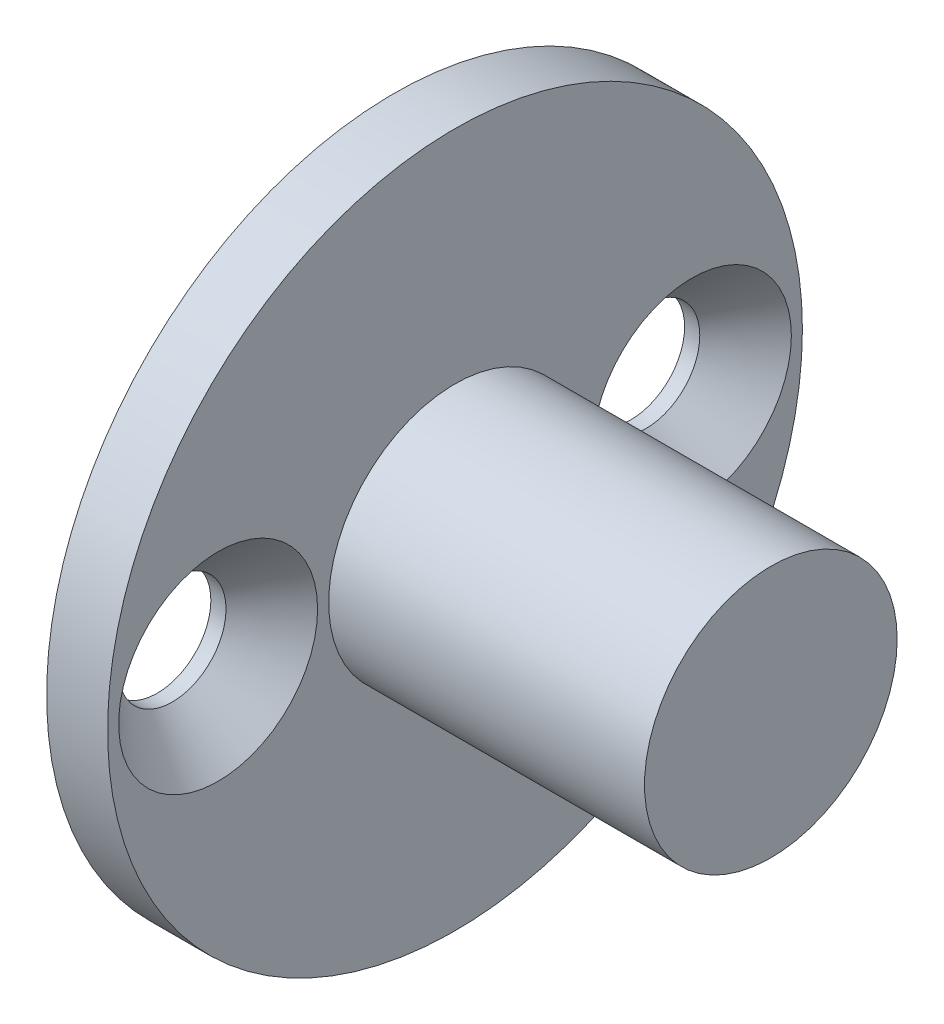
from build123d import *

# Parameters (mm, degrees)
SKETCH1_R                                      = 11
SKETCH1_R_2                                    = 1.6
BOSS_EXTRUDE1_DEPTH                            = 1.93
SKETCH2_R                                      = 4
BOSS_EXTRUDE2_DEPTH                            = 10
SKETCH3_R                                      = 2.15
CUT_EXTRUDE1_DEPTH                             = 6
CSK_FOR_M3_FLAT_HEAD_MACHINE_SCREW1_AT_2_COUNT = 2
CSK_FOR_M3_FLAT_HEAD_MACHINE_SCREW1_AT_2_PITCH = 15


with BuildPart() as part:
    # Sketch1 → Boss-Extrude1 (new body)
    with BuildSketch(Plane(origin=(0, 0, 0), x_dir=(0, 0, -1), z_dir=(1, 0, 0))):
        Circle(SKETCH1_R)
        with Locations((7.5, 0)):
            Circle(SKETCH1_R_2, mode=Mode.SUBTRACT)
        with Locations((-7.5, 0)):
            Circle(SKETCH1_R_2, mode=Mode.SUBTRACT)
    extrude(amount=BOSS_EXTRUDE1_DEPTH)

    # Sketch2 → Boss-Extrude2 (add)
    with BuildSketch(Plane(origin=(1.93, 0, 0), x_dir=(0, 0, -1), z_dir=(1, 0, 0))):
        Circle(SKETCH2_R)
    extrude(amount=BOSS_EXTRUDE2_DEPTH)

    # Sketch3 → Cut-Extrude1 (cut)
    with BuildSketch(Plane(origin=(0, 0, 0), x_dir=(0, 0, -1), z_dir=(1, 0, 0))):
        Circle(SKETCH3_R)
    extrude(amount=CUT_EXTRUDE1_DEPTH, mode=Mode.SUBTRACT)

    # Sketch5 → CSK for M3 Flat Head Machine Screw1 (revolve, cut)
    with BuildSketch(Plane(origin=(1.93, 0, 7.5), x_dir=(0, 0, -1), z_dir=(0, 1, 0))):
        Polygon((0, 0), (0, 1.93), (1.7, 1.93), (1.7, 1.45), (3.15, 0), align=None)
    csk_for_m3_flat_head_machine_screw1 = revolve(axis=Axis((8.28, 0, 7.5), (-1, 0, 0)), mode=Mode.SUBTRACT)

    # CSK for M3 Flat Head Machine Screw1 at 2: CSK for M3 Flat Head Machine Screw1 ×2
    with Locations(*[(0, 0, -i * CSK_FOR_M3_FLAT_HEAD_MACHINE_SCREW1_AT_2_PITCH) for i in range(1, CSK_FOR_M3_FLAT_HEAD_MACHINE_SCREW1_AT_2_COUNT)]):
        add(csk_for_m3_flat_head_machine_screw1, mode=Mode.SUBTRACT)


solid = part.part
